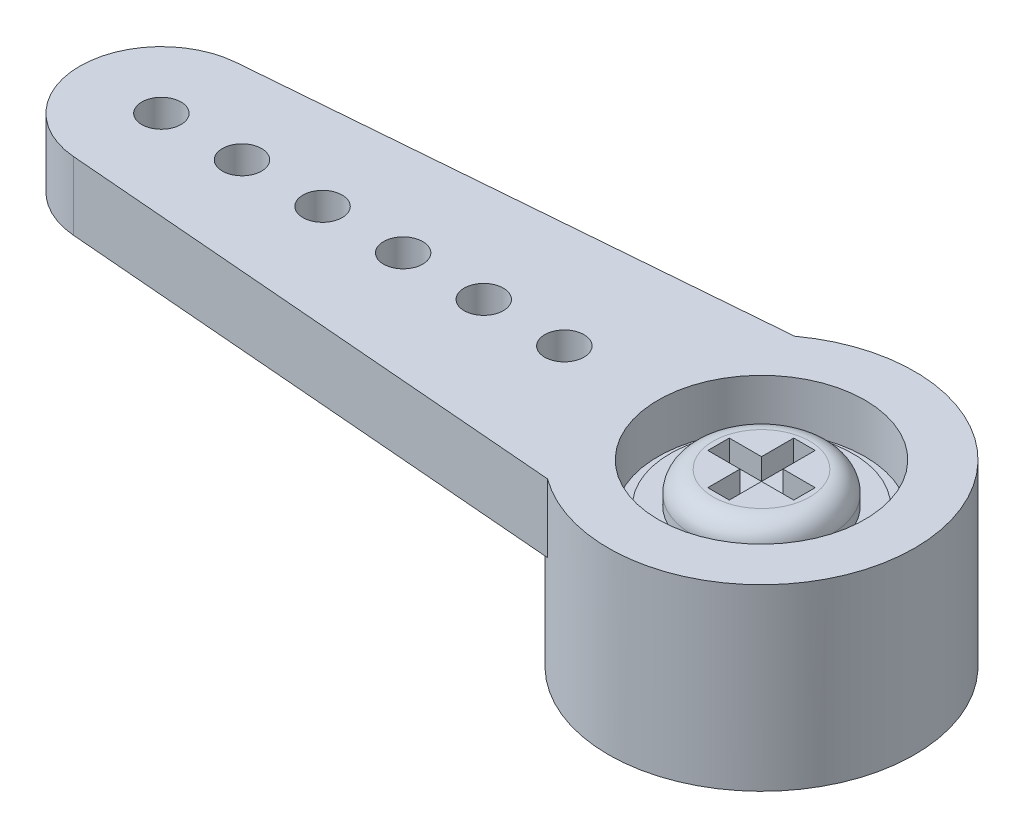
from build123d import *

# Parameters (mm, degrees)
EXTRUDE17_DEPTH = 1.6129
EXTRUDE19_START = -4.2291
SKETCH19_R      = 3.6195
EXTRUDE19_DEPTH = 4.2291
SKETCH20_R      = 0.46355
SKETCH20_R_2    = 1.27
EXTRUDE20_DEPTH = 18.050548166
SKETCH21_R      = 2.44475
EXTRUDE21_DEPTH = 1.1557
SKETCH22_R      = 2.286
EXTRUDE22_DEPTH = 2.3368
SKETCH23_R      = 2.159
EXTRUDE23_DEPTH = 0.2032
SKETCH24_R      = 1.651
EXTRUDE24_DEPTH = 0.762
EXTRUDE25_DEPTH = 0.508
FILLET1_R       = 0.508


with BuildPart() as part:
    # Sketch18 → Extrude17 (new body)
    with BuildSketch(Plane(origin=(0, 0, 0), x_dir=(1, 0, 0), z_dir=(0, 1, 0))):
        with BuildLine():
            Line((-14.34305969, 1.923991942), (-2.13741415, 2.921))
            ThreePointArc((-2.13741415, 2.921), (3.6195, 0), (-2.13741415, -2.921))
            Line((-2.13741415, -2.921), (-14.34305969, -1.923991942))
            ThreePointArc((-14.34305969, -1.923991942), (-16.1163, 0), (-14.34305969, 1.923991942))
        make_face()
    extrude(amount=EXTRUDE17_DEPTH)

    # Sketch19 → Extrude19 (add)
    with BuildSketch(Plane(origin=(0, 1.6129, 0), x_dir=(1, 0, 0), z_dir=(0, 1, 0)).offset(EXTRUDE19_START)):
        with Locations(Location((0, 0, 0), (0, 0, 126.194447475))):
            Circle(SKETCH19_R)
    extrude(amount=EXTRUDE19_DEPTH)

    # Sketch20 → Extrude20 (cut, through all)
    with BuildSketch(Plane(origin=(0, 1.6129, 0), x_dir=(1, 0, 0), z_dir=(0, 1, 0))):
        with Locations(Location((-14.1859, 0, 0), (0, 0, 270))):
            Circle(SKETCH20_R)
        with Locations(Location((0, 0, 0), (0, 0, 270))):
            Circle(SKETCH20_R_2)
        with Locations(Location((-4.6609, 0, 0), (0, 0, 270))):
            Circle(SKETCH20_R)
        with Locations(Location((-6.5659, 0, 0), (0, 0, 270))):
            Circle(SKETCH20_R)
        with Locations(Location((-8.4709, 0, 0), (0, 0, 270))):
            Circle(SKETCH20_R)
        with Locations(Location((-10.3759, 0, 0), (0, 0, 270))):
            Circle(SKETCH20_R)
        with Locations(Location((-12.2809, 0, 0), (0, 0, 270))):
            Circle(SKETCH20_R)
    extrude(amount=-EXTRUDE20_DEPTH, mode=Mode.SUBTRACT)

    # Sketch21 → Extrude21 (cut)
    with BuildSketch(Plane(origin=(0, 1.6129, 0), x_dir=(1, 0, 0), z_dir=(0, 1, 0))):
        with Locations(Location((0, 0, 0), (0, 0, 270))):
            Circle(SKETCH21_R)
    extrude(amount=-EXTRUDE21_DEPTH, mode=Mode.SUBTRACT)

    # Sketch22 → Extrude22 (cut)
    with BuildSketch(Plane.XZ.offset(2.6162)):
        with Locations(Location((0, 0, 0), (0, 0, 270))):
            Circle(SKETCH22_R)
    extrude(amount=-EXTRUDE22_DEPTH, mode=Mode.SUBTRACT)



with BuildPart() as body_2:
    # Sketch23 → Extrude23 (new body)
    with BuildSketch(Plane(origin=(0, 0.4572, 0), x_dir=(1, 0, 0), z_dir=(0, 1, 0))):
        with Locations(Location((0, 0, 0), (0, 0, 270))):
            Circle(SKETCH23_R)
    extrude(amount=EXTRUDE23_DEPTH)


with BuildPart() as part_1:
    add(part.part)

    add(body_2.part)  # Extrude24 merges body 2
    # Sketch24 → Extrude24 (add)
    with BuildSketch(Plane(origin=(0, 0.6604, 0), x_dir=(1, 0, 0), z_dir=(0, 1, 0))):
        with Locations(Location((0, 0, 0), (0, 0, 90))):
            Circle(SKETCH24_R)
    extrude(amount=EXTRUDE24_DEPTH)

    # Sketch25 → Extrude25 (cut)
    with BuildSketch(Plane(origin=(0, 1.4224, 0), x_dir=(1, 0, 0), z_dir=(0, 1, 0))):
        Polygon((0.254, -1.016), (-0.254, -1.016), (-0.254, -0.254), (-1.016, -0.254), (-1.016, 0.254), (-0.254, 0.254), (-0.254, 1.016), (0.254, 1.016), (0.254, 0.254), (1.016, 0.254), (1.016, -0.254), (0.254, -0.254), align=None)
    extrude(amount=-EXTRUDE25_DEPTH, mode=Mode.SUBTRACT)

    # Fillet1
    fillet1_edges = [part_1.edges().sort_by_distance(p)[0] for p in [
        (0, 1.4224, 1.651),
    ]]
    fillet(fillet1_edges, radius=FILLET1_R)


solid = part_1.part
